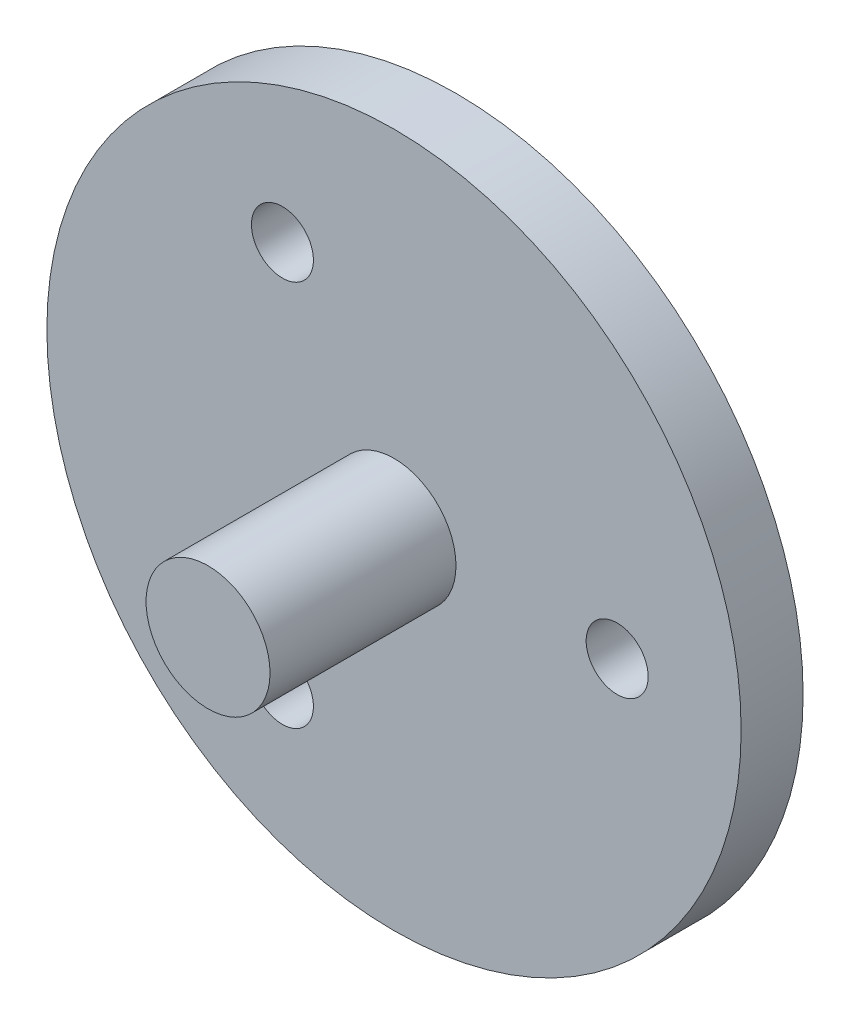
from build123d import *

# Parameters (mm, degrees)
SKETCH1_R           = 56
BOSS_EXTRUDE1_DEPTH = 10
SKETCH2_R           = 10
BOSS_EXTRUDE2_DEPTH = 30
SKETCH3_R           = 5
CUT_EXTRUDE1_DEPTH  = 10


with BuildPart() as part:
    # Sketch1 → Boss-Extrude1 (new body)
    with BuildSketch(Plane.XY):
        Circle(SKETCH1_R)
    extrude(amount=BOSS_EXTRUDE1_DEPTH)

    # Sketch2 → Boss-Extrude2 (add)
    with BuildSketch(Plane.XY.offset(10)):
        Circle(SKETCH2_R)
    extrude(amount=BOSS_EXTRUDE2_DEPTH)

    # Sketch3 → Cut-Extrude1 (cut)
    with BuildSketch(Plane.XY.offset(10)):
        with Locations((36, 0)):
            Circle(SKETCH3_R)
        with Locations((-18, 31.176914536)):
            Circle(SKETCH3_R)
        with Locations((-18, -31.176914536)):
            Circle(SKETCH3_R)
    extrude(amount=-CUT_EXTRUDE1_DEPTH, mode=Mode.SUBTRACT)


solid = part.part
